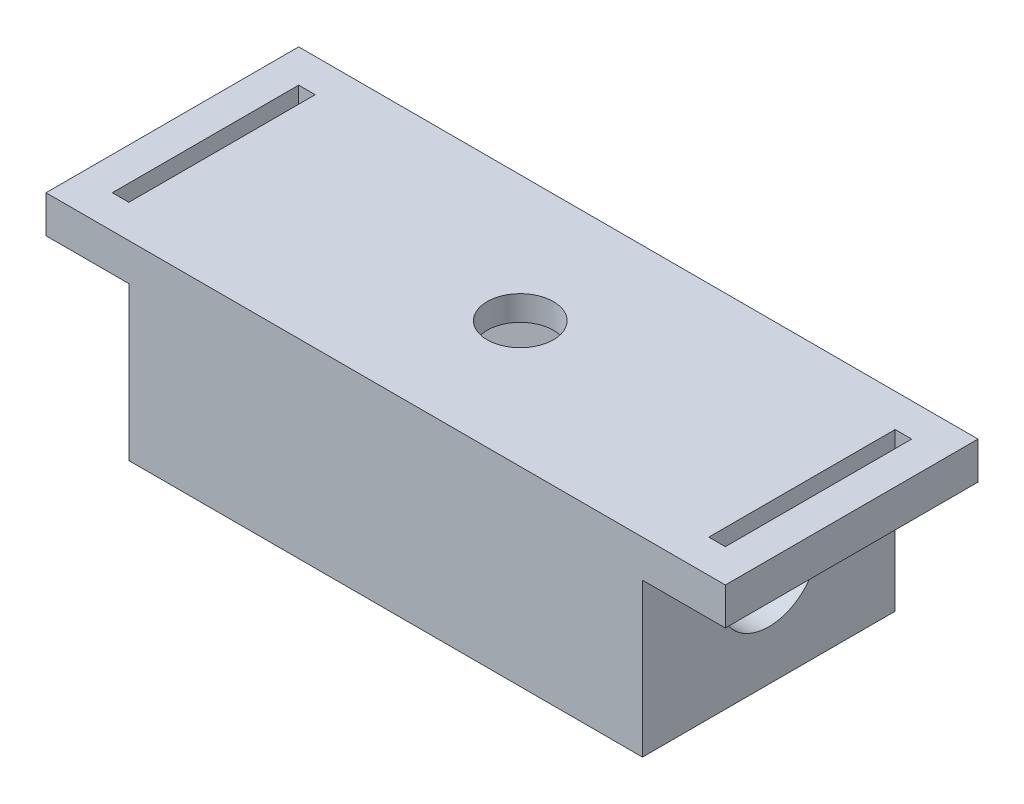
from build123d import *

# Parameters (mm, degrees)
SKETCH_1_W          = 66
SKETCH_1_H          = 30.5
SKETCH_1_W_2        = 58
SKETCH_1_H_2        = 22.5
EXTRUDE_1_DEPTH     = 27
SKETCH_2_W          = 66
SKETCH_2_H          = 30.5
EXTRUDE_2_DEPTH     = 3
SKETCH_3_R          = 4
CUT_EXTRUDE_1_DEPTH = 52.517321124
SKETCH_4_R          = 6
CUT_EXTRUDE_2_DEPTH = 11
SKETCH_5_W          = 4
SKETCH_5_H          = 30.5
CUT_EXTRUDE_3_DEPTH = 52.517321124
SKETCH_6_W          = 30.5
SKETCH_6_H          = 4.5
EXTRUDE_3_DEPTH     = 10
SKETCH_7_W          = 2
SKETCH_7_H          = 22.5
CUT_EXTRUDE_4_DEPTH = 10
SKETCH_8_W          = 30.5
SKETCH_8_H          = 4.5
EXTRUDE_4_DEPTH     = 10
SKETCH_9_W          = 2
SKETCH_9_H          = 22.5
CUT_EXTRUDE_5_DEPTH = 10
SKETCH_10_W         = 62
SKETCH_10_H         = 30.5
CUT_EXTRUDE_6_DEPTH = 4


with BuildPart() as part:
    # 草图1 → 凸台-拉伸1 (new body)
    with BuildSketch(Plane(origin=(0, 0, 0), x_dir=(1, 0, 0), z_dir=(0, 1, 0))):
        with Locations((4.387096774, -7.711693548)):
            Rectangle(SKETCH_1_W, SKETCH_1_H)
        with Locations((4.387096774, -7.711693548)):
            Rectangle(SKETCH_1_W_2, SKETCH_1_H_2, mode=Mode.SUBTRACT)
    extrude(amount=EXTRUDE_1_DEPTH)

    # 草图2 → 凸台-拉伸2 (add)
    with BuildSketch(Plane(origin=(0, 27, 0), x_dir=(1, 0, 0), z_dir=(0, 1, 0))):
        with Locations((4.387096774, -7.711693548)):
            Rectangle(SKETCH_2_W, SKETCH_2_H)
    extrude(amount=-EXTRUDE_2_DEPTH)

    # 草图3 → 切除-拉伸1 (cut, through all)
    with BuildSketch(Plane(origin=(0, 27, 0), x_dir=(1, 0, 0), z_dir=(0, 1, 0))):
        with Locations(Location((7.387096774, -7.711693548, 0), (0, 0, 270))):
            Circle(SKETCH_3_R)
    extrude(amount=-CUT_EXTRUDE_1_DEPTH, mode=Mode.SUBTRACT)

    # 草图4 → 切除-拉伸2 (cut)
    with BuildSketch(Plane.ZY.offset(-33.387096774)):
        with Locations((7.711693548, 16)):
            Circle(SKETCH_4_R)
    extrude(amount=-CUT_EXTRUDE_2_DEPTH, mode=Mode.SUBTRACT)

    # 草图5 → 切除-拉伸3 (cut, through all)
    with BuildSketch(Plane.XZ):
        with Locations((-26.612903226, 7.711693548)):
            Rectangle(SKETCH_5_W, SKETCH_5_H)
    extrude(amount=-CUT_EXTRUDE_3_DEPTH, mode=Mode.SUBTRACT)

    # 草图6 → 凸台-拉伸3 (add)
    with BuildSketch(Plane(origin=(37.387096774, 0, 0), x_dir=(0, 0, -1), z_dir=(1, 0, 0))):
        with Locations((-7.711693548, 24.75)):
            Rectangle(SKETCH_6_W, SKETCH_6_H)
    extrude(amount=EXTRUDE_3_DEPTH)

    # 草图7 → 切除-拉伸4 (cut)
    with BuildSketch(Plane.XZ.offset(-22.5)):
        with Locations((42.387096774, 7.711693548)):
            Rectangle(SKETCH_7_W, SKETCH_7_H)
    extrude(amount=-CUT_EXTRUDE_4_DEPTH, mode=Mode.SUBTRACT)

    # 草图8 → 凸台-拉伸4 (add)
    with BuildSketch(Plane.ZY.offset(24.612903226)):
        with Locations((7.711693548, 24.75)):
            Rectangle(SKETCH_8_W, SKETCH_8_H)
    extrude(amount=EXTRUDE_4_DEPTH)

    # 草图9 → 切除-拉伸5 (cut)
    with BuildSketch(Plane.XZ.offset(-22.5)):
        with Locations((-29.612903226, 7.711693548)):
            Rectangle(SKETCH_9_W, SKETCH_9_H)
    extrude(amount=-CUT_EXTRUDE_5_DEPTH, mode=Mode.SUBTRACT)

    # 草图10 → 切除-拉伸6 (cut)
    with BuildSketch(Plane.XZ):
        with Locations((6.387096774, 7.711693548)):
            Rectangle(SKETCH_10_W, SKETCH_10_H)
    extrude(amount=-CUT_EXTRUDE_6_DEPTH, mode=Mode.SUBTRACT)


solid = part.part
